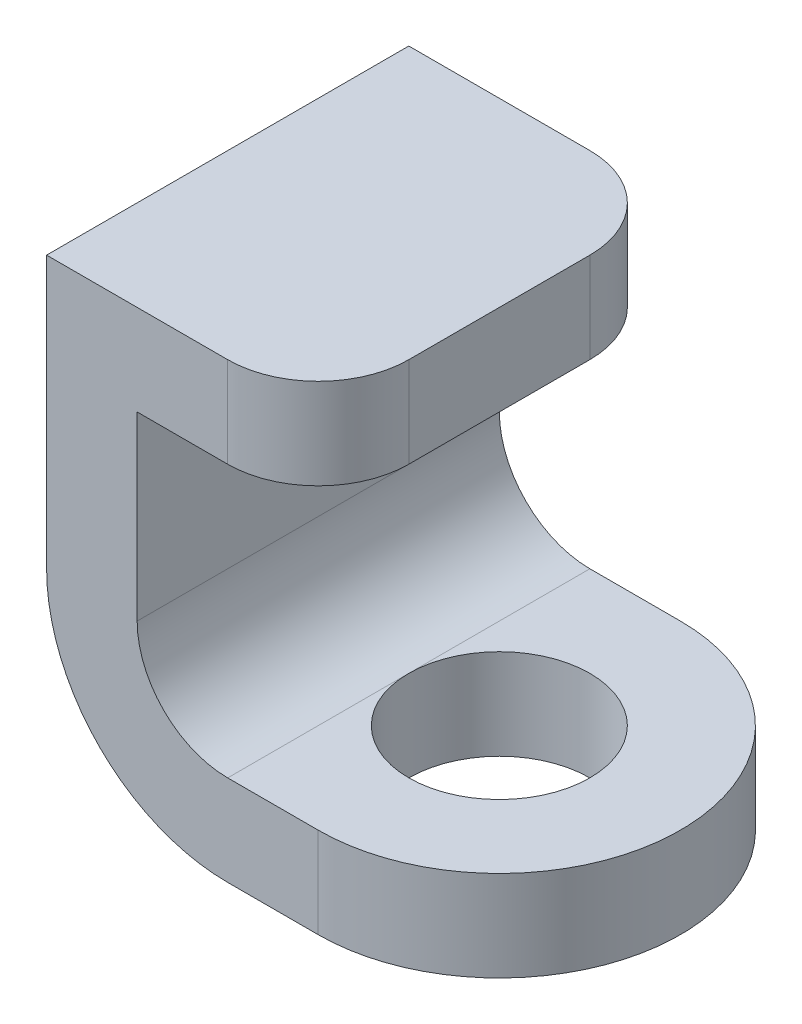
from build123d import *

# Parameters (mm, degrees)
BOSS_EXTRUDE1_DEPTH = 40
SKETCH3_OUTSIDE_W   = 68.248
SKETCH3_OUTSIDE_H   = 58.248
CUT_EXTRUDE1_DEPTH  = 40
SKETCH4_OUTSIDE_W   = 68.248
SKETCH4_OUTSIDE_H   = 58.248
SKETCH4_OUTSIDE_R   = 10
CUT_EXTRUDE4_DEPTH  = 40


with BuildPart() as part:
    # Sketch2 → Boss-Extrude1 (new body)
    with BuildSketch(Plane.XY):
        with BuildLine():
            Line((2.466960352, 28.854625551), (-27.533039648, 28.854625551))
            Line((-27.533039648, 28.854625551), (-27.533039648, -1.145374449))
            ThreePointArc((-27.533039648, -1.145374449), (-21.675175271, -15.287510073), (-7.533039648, -21.145374449))
            Line((-7.533039648, -21.145374449), (22.466960352, -21.145374449))
            Line((22.466960352, -21.145374449), (22.466960352, -11.145374449))
            Line((22.466960352, -11.145374449), (-7.533039648, -11.145374449))
            ThreePointArc((-7.533039648, -11.145374449), (-14.604107459, -8.216442261), (-17.533039648, -1.145374449))
            Line((-17.533039648, -1.145374449), (-17.533039648, 18.854625551))
            Line((-17.533039648, 18.854625551), (2.466960352, 18.854625551))
            Line((2.466960352, 18.854625551), (2.466960352, 28.854625551))
        make_face()
    extrude(amount=BOSS_EXTRUDE1_DEPTH)

    # Sketch3 outside → Cut-Extrude1 (cut)
    with BuildSketch(Plane(origin=(0, 28.854625551, 0), x_dir=(1, 0, 0), z_dir=(0, 1, 0))):
        with Locations((-2.533, -20)):
            Rectangle(SKETCH3_OUTSIDE_W, SKETCH3_OUTSIDE_H)
        with BuildLine():
            Line((-27.533039648, 0), (-27.533039648, -40))
            Line((-27.533039648, -40), (-7.533039648, -40))
            ThreePointArc((-7.533039648, -40), (-0.461971836, -37.071067812), (2.466960352, -30))
            Line((2.466960352, -30), (2.466960352, -10))
            ThreePointArc((2.466960352, -10), (-0.461971836, -2.928932188), (-7.533039648, 0))
            Line((-7.533039648, 0), (-27.533039648, 0))
        make_face(mode=Mode.SUBTRACT)
    extrude(amount=-CUT_EXTRUDE1_DEPTH, mode=Mode.SUBTRACT)

    # Sketch4 outside → Cut-Extrude4 (cut)
    # profile 1 of 2: a face of its own
    with BuildSketch(Plane.XZ.offset(21.145374449)):
        with Locations((-2.533, 20)):
            Rectangle(SKETCH4_OUTSIDE_W, SKETCH4_OUTSIDE_H)
        with BuildLine():
            Line((-7.533039648, 40), (-27.533039648, 40))
            Line((-27.533039648, 40), (-27.533039648, 0))
            Line((-27.533039648, 0), (-7.533039648, 0))
            Line((-7.533039648, 0), (2.466960352, 0))
            ThreePointArc((2.466960352, 0), (22.466960352, 20), (2.466960352, 40))
            Line((2.466960352, 40), (-7.533039648, 40))
        make_face(mode=Mode.SUBTRACT)
    # profile 2 of 2: a face of its own
    with BuildSketch(Plane.XZ.offset(21.145374449)):
        with Locations(Location((2.466960352, 20, 0), (0, 0, 180))):
            Circle(SKETCH4_OUTSIDE_R)
    extrude(amount=-CUT_EXTRUDE4_DEPTH, mode=Mode.SUBTRACT)


solid = part.part
